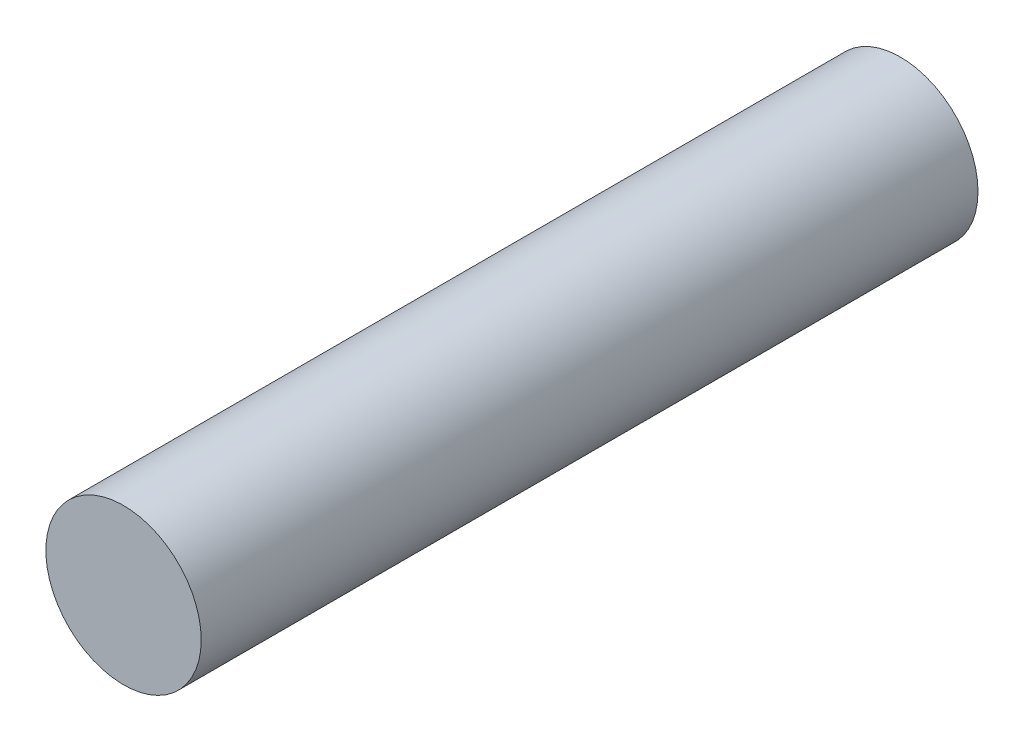
from build123d import *

# Parameters (mm, degrees)
SKETCH_1_R      = 5
EXTRUDE_1_DEPTH = 50


with BuildPart() as part:
    # ｽｹｯﾁ1 → ﾎﾞｽ - 押し出し1 (new body)
    with BuildSketch(Plane.XY):
        Circle(SKETCH_1_R)
    extrude(amount=EXTRUDE_1_DEPTH)


solid = part.part
